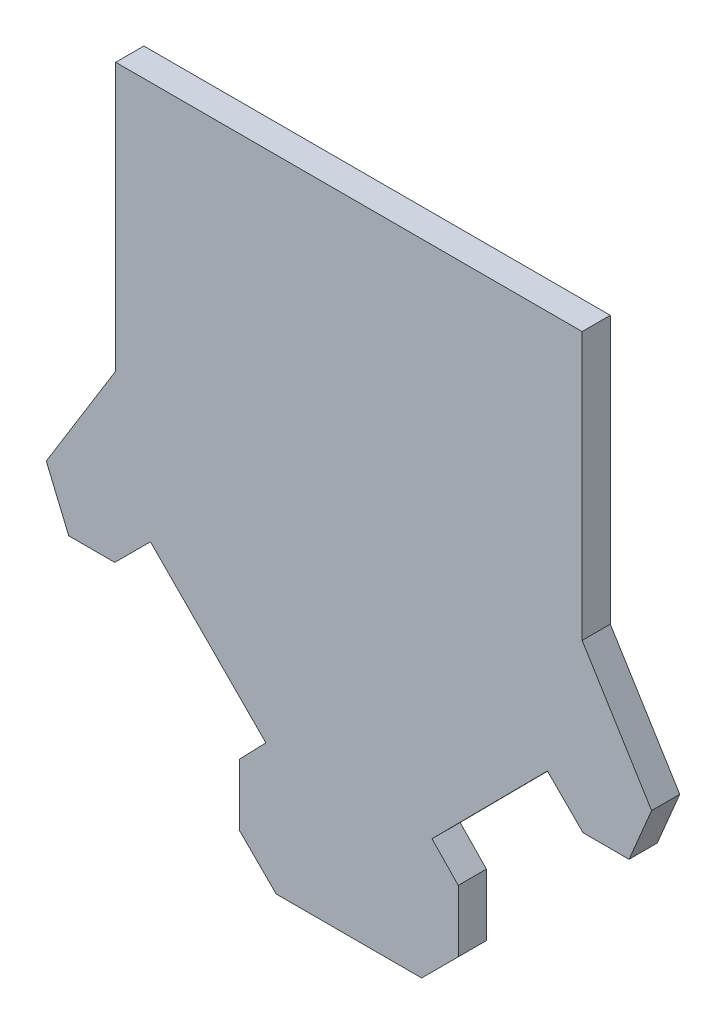
from build123d import *

# Parameters (mm, degrees)
EXTRUDE1_DEPTH = 3


with BuildPart() as part:
    # Sketch1 → Extrude1 (new body)
    with BuildSketch(Plane.XY):
        Polygon((49.7, 0), (24.85, 0), (24.85, -68.2), (32.6, -68.2), (36.5, -64.3), (36.5, -57.7), (33.7, -54.8), (46, -42.4), (49.8, -46.2), (54.7, -46.2), (57.1, -40.5), (49.7, -28.5), align=None)
        Polygon((24.85, 0), (0, 0), (0, -28.5), (-7.4, -40.5), (-5, -46.2), (-0.1, -46.2), (3.7, -42.4), (16, -54.8), (13.2, -57.7), (13.2, -64.3), (17.1, -68.2), (24.85, -68.2), align=None)
    extrude(amount=EXTRUDE1_DEPTH)


solid = part.part
